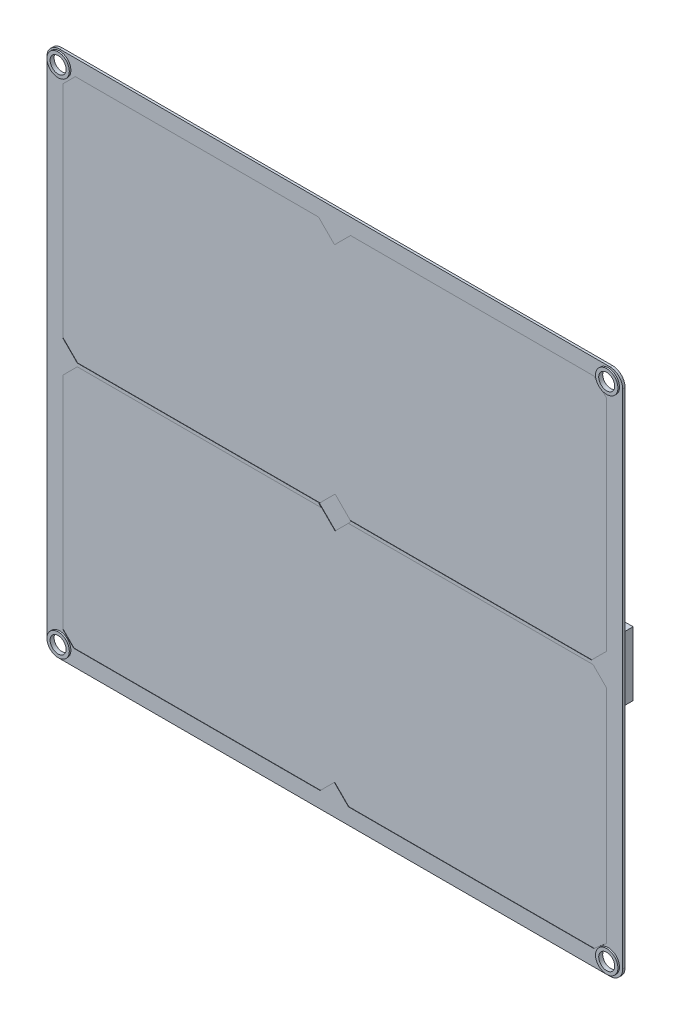
from build123d import *

# Parameters (mm, degrees)
ESQUISSE1_W                     = 360
ESQUISSE1_H                     = 330
BOSS_EXTRU_1_DEPTH              = 1.5
ESQUISSE2_R                     = 5
ENL_V_MAT_EXTRU_1_DEPTH         = 1.5
BOSS_EXTRU_2_START              = 1
ESQUISSE3_R                     = 7
ESQUISSE3_R_2                   = 5
BOSS_EXTRU_2_DEPTH              = 1
CONG_2_R                        = 8
CONG_4_R                        = 8
R_P_TITION_LIN_AIRE2_COUNT      = 2
R_P_TITION_LIN_AIRE2_PITCH      = 343
R_P_TITION_LIN_AIRE2_COUNT_DIR2 = 2
R_P_TITION_LIN_AIRE2_PITCH_DIR2 = 314
ENL_V_MAT_EXTRU_2_DEPTH         = 0.2
ENL_V_MAT_EXTRU_3_DEPTH         = 0.2
BOSS_EXTRU_3_DEPTH              = 0.2
BOSS_EXTRU_4_DEPTH              = 0.2
BOSS_EXTRU_5_DEPTH              = 0.2
ESQUISSE9_W                     = 40
ESQUISSE9_H                     = 40
BOSS_EXTRU_6_DEPTH              = 10


with BuildPart() as part:
    # Esquisse1 → Boss.-Extru.1 (new body)
    with BuildSketch(Plane.XY):
        with Locations((-180, 165)):
            Rectangle(ESQUISSE1_W, ESQUISSE1_H)
    extrude(amount=BOSS_EXTRU_1_DEPTH)

    # Esquisse2 → Enlèv. mat.-Extru.1 (cut)
    with BuildSketch(Plane.XY.offset(1.5)):
        with Locations((-352, 322)):
            Circle(ESQUISSE2_R)
    enl_v_mat_extru_1 = extrude(amount=-ENL_V_MAT_EXTRU_1_DEPTH, mode=Mode.SUBTRACT)

    # Esquisse3 → Boss.-Extru.2 (add)
    with BuildSketch(Plane.XY.offset(1.5).offset(BOSS_EXTRU_2_START)):
        with Locations((-352, 322)):
            Circle(ESQUISSE3_R)
        with Locations((-352, 322)):
            Circle(ESQUISSE3_R_2, mode=Mode.SUBTRACT)
    boss_extru_2 = extrude(amount=-BOSS_EXTRU_2_DEPTH)

    # Congé2
    cong_2_edges = [part.edges().sort_by_distance(p)[0] for p in [
        (-360, 0, 0.75),
        (-360, 330, 0.75),
    ]]
    fillet(cong_2_edges, radius=CONG_2_R)

    # Congé4
    cong_4_edges = [part.edges().sort_by_distance(p)[0] for p in [
        (0, 0, 0.75),
        (0, 330, 0.75),
    ]]
    fillet(cong_4_edges, radius=CONG_4_R)

    # Répétition linéaire2: Enlèv. mat.-Extru.1, Boss.-Extru.2 2 × 2
    with Locations(*[(i * R_P_TITION_LIN_AIRE2_PITCH, -j * R_P_TITION_LIN_AIRE2_PITCH_DIR2, 0) for i in range(R_P_TITION_LIN_AIRE2_COUNT) for j in range(R_P_TITION_LIN_AIRE2_COUNT_DIR2) if (i, j) != (0, 0)]):
        add(enl_v_mat_extru_1, mode=Mode.SUBTRACT)
        add(boss_extru_2)

    # Esquisse4 → Enlèv. mat.-Extru.2 (cut)
    with BuildSketch(Plane.XY.offset(1.5)):
        Polygon((-342.224801163, 320), (-18.072831487, 320), (-10, 311.927168513), (-10, 16.768229134), (-18.072831487, 10), (-343.231770866, 10), (-350, 16.768229134), (-350, 312.224801163), align=None)
    extrude(amount=-ENL_V_MAT_EXTRU_2_DEPTH, mode=Mode.SUBTRACT)

    # Esquisse5 → Enlèv. mat.-Extru.3 (cut)
    with BuildSketch(Plane.XY.offset(1.3)):
        Polygon((-180, 155), (-170, 165), (-180, 175), (-190, 165), align=None)
    extrude(amount=-ENL_V_MAT_EXTRU_3_DEPTH, mode=Mode.SUBTRACT)

    # Esquisse6 → Boss.-Extru.3 (add)
    with BuildSketch(Plane.XY.offset(1.3)):
        Polygon((-190.148829514, 320), (-180.16505775, 310.000013168), (-170.148829514, 320), align=None)
        Polygon((-350, 174.492138197), (-340, 164.492138197), (-350, 154.492138197), align=None)
        Polygon((-190.285016954, 8.853157765), (-180.292495127, 18.844401072), (-170.285024617, 8.835649966), align=None)
    extrude(amount=BOSS_EXTRU_3_DEPTH)

    # Esquisse7 → Boss.-Extru.4 (add)
    with BuildSketch(Plane.XY.offset(1.3)):
        Polygon((-10, 175), (-20, 165), (-10, 155), align=None)
    extrude(amount=BOSS_EXTRU_4_DEPTH)

    # Esquisse8 → Boss.-Extru.5 (add)
    with BuildSketch(Plane.XY.offset(1.3)):
        Polygon((-341, 163.492138197), (-188.492138197, 163.492138197), (-190, 165), (-189.507861803, 165.492138197), (-341, 165.492138197), align=None)
        Polygon((-6.914170883, 165.492138197), (-6.914170883, 163.492138197), (-171.507861803, 163.492138197), (-170, 165), (-170.492138197, 165.492138197), align=None)
    extrude(amount=BOSS_EXTRU_5_DEPTH)

    # Esquisse9 → Boss.-Extru.6 (add)
    with BuildSketch(Plane(origin=(0, 0, 0), x_dir=(-1, 0, 0), z_dir=(0, 0, -1))):
        with Locations((25, 165)):
            Rectangle(ESQUISSE9_W, ESQUISSE9_H)
    extrude(amount=BOSS_EXTRU_6_DEPTH)


solid = part.part
